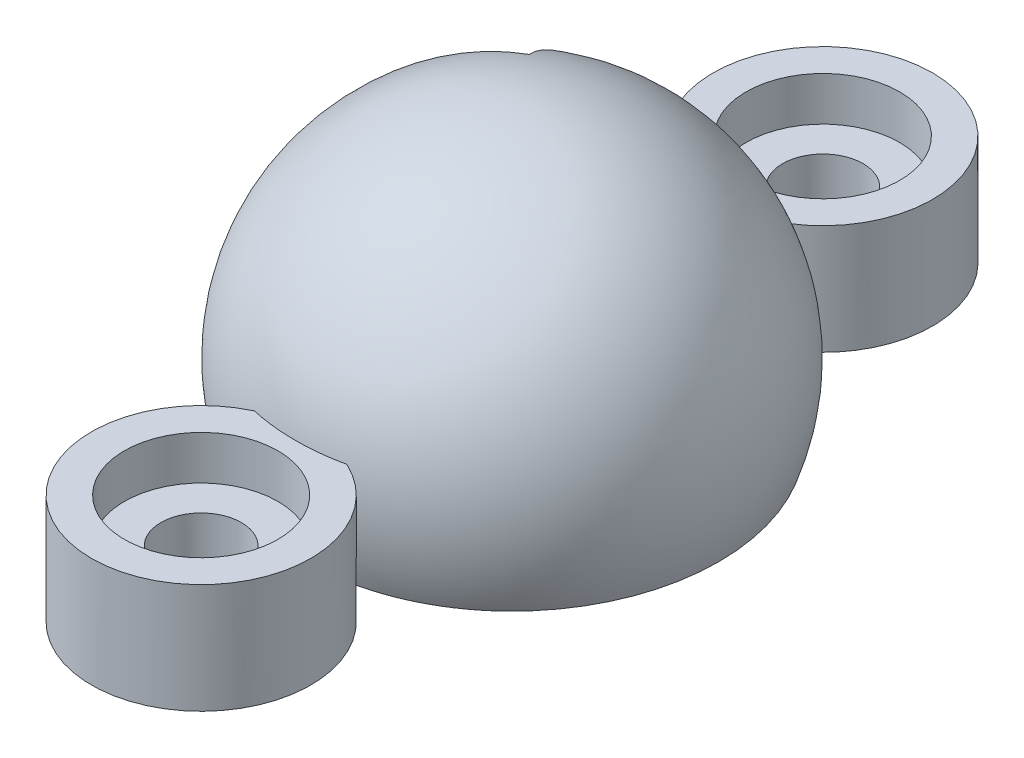
from build123d import *

# Parameters (mm, degrees)
RETAINER_FEATURE_2_PROFILE_W = 14
RETAINER_FEATURE_2_PROFILE_H = 5
RETAINER_FEATURE_2_DEPTH     = 14
RETAINER_FEATURE_3_PROFILE_R = 3
RETAINER_FEATURE_3_DEPTH     = 3
RETAINER_FEATURE_4_PROFILE_R = 3
RETAINER_FEATURE_4_DEPTH     = 3
RETAINER_FEATURE_6_PROFILE_R = 1.1
RETAINER_FEATURE_6_DEPTH     = 4.25
RETAINER_FEATURE_7_PROFILE_R = 2.1
RETAINER_FEATURE_7_DEPTH     = 1.45
RETAINER_FEATURE_8_PROFILE_R = 1.1
RETAINER_FEATURE_8_DEPTH     = 4.25
RETAINER_FEATURE_9_PROFILE_R = 2.1
RETAINER_FEATURE_9_DEPTH     = 1.45
RETAINER_FEATURE_12_DEPTH    = 10


with BuildPart() as part:
    # Retainer Feature 1 profile → Retainer Feature 1 (revolve)
    with BuildSketch(Plane(origin=(0, -73, 0), x_dir=(-1, 0, 0), z_dir=(0, -1, 0))):
        with BuildLine():
            Line((26.291651246, -6), (26.291651246, 6))
            ThreePointArc((26.291651246, 6), (20.291651246, 0), (26.291651246, -6))
        make_face()
    revolve(axis=Axis((-26.291651246, -73, -10), (0, 0, 1)))

    # Retainer Feature 2 profile → Retainer Feature 2 (cut)
    with BuildSketch(Plane.XY.offset(-7)):
        with Locations((-26.291651246, -68.5)):
            Rectangle(RETAINER_FEATURE_2_PROFILE_W, RETAINER_FEATURE_2_PROFILE_H)
    extrude(amount=RETAINER_FEATURE_2_DEPTH, mode=Mode.SUBTRACT)

    # Retainer Feature 3 profile → Retainer Feature 3 (add)
    with BuildSketch(Plane(origin=(0, -71, 0), x_dir=(-1, 0, 0), z_dir=(0, -1, 0))):
        with Locations((26.291651246, 8.5)):
            Circle(RETAINER_FEATURE_3_PROFILE_R)
    extrude(amount=RETAINER_FEATURE_3_DEPTH)

    # Retainer Feature 4 profile → Retainer Feature 4 (add)
    with BuildSketch(Plane(origin=(0, -71, 0), x_dir=(-1, 0, 0), z_dir=(0, -1, 0))):
        with Locations((26.291651246, -8.5)):
            Circle(RETAINER_FEATURE_4_PROFILE_R)
    extrude(amount=RETAINER_FEATURE_4_DEPTH)

    # Retainer Feature 5 profile → Retainer Feature 5 (revolve, cut)
    with BuildSketch(Plane(origin=(0, -73, 0), x_dir=(-1, 0, 0), z_dir=(0, -1, 0))):
        with BuildLine():
            Line((26.291651246, -3.15), (26.291651246, 3.15))
            ThreePointArc((26.291651246, 3.15), (23.141651246, 0), (26.291651246, -3.15))
        make_face()
    revolve(axis=Axis((-26.291651246, -73, -10), (0, 0, 1)), mode=Mode.SUBTRACT)

    # Retainer Feature 6 profile → Retainer Feature 6 (cut)
    with BuildSketch(Plane(origin=(0, -70, 0), x_dir=(-1, 0, 0), z_dir=(0, -1, 0))):
        with Locations(Location((26.291651246, 8.5, 0), (0, 0, 270))):
            Circle(RETAINER_FEATURE_6_PROFILE_R)
    extrude(amount=RETAINER_FEATURE_6_DEPTH, mode=Mode.SUBTRACT)

    # Retainer Feature 7 profile → Retainer Feature 7 (cut)
    with BuildSketch(Plane(origin=(0, -72.8, 0), x_dir=(-1, 0, 0), z_dir=(0, -1, 0))):
        with Locations(Location((26.291651246, 8.5, 0), (0, 0, 90))):
            Circle(RETAINER_FEATURE_7_PROFILE_R)
    extrude(amount=RETAINER_FEATURE_7_DEPTH, mode=Mode.SUBTRACT)

    # Retainer Feature 8 profile → Retainer Feature 8 (cut)
    with BuildSketch(Plane(origin=(0, -70, 0), x_dir=(-1, 0, 0), z_dir=(0, -1, 0))):
        with Locations(Location((26.291651246, -8.5, 0), (0, 0, 270))):
            Circle(RETAINER_FEATURE_8_PROFILE_R)
    extrude(amount=RETAINER_FEATURE_8_DEPTH, mode=Mode.SUBTRACT)

    # Retainer Feature 9 profile → Retainer Feature 9 (cut)
    with BuildSketch(Plane(origin=(0, -72.8, 0), x_dir=(-1, 0, 0), z_dir=(0, -1, 0))):
        with Locations(Location((26.291651246, -8.5, 0), (0, 0, 90))):
            Circle(RETAINER_FEATURE_9_PROFILE_R)
    extrude(amount=RETAINER_FEATURE_9_DEPTH, mode=Mode.SUBTRACT)

    # Middle Right Fixed Compression Ball Reta → Retainer Feature 12 (cut)
    with BuildSketch(Plane(origin=(-46.801806266, -32.220261504, -18.815460044), x_dir=(-0.25892602820646665, -0.17825517869277457, 0.9493062747008634), z_dir=(-0.7819246728070284, -0.5383086561091627, -0.3143526631246647))):
        Polygon((20.297287002, -41.528985171), (16.35135873, -46.567799523), (19.343154751, -48.910694434), (23.289083023, -43.871880083), align=None)
    extrude(amount=RETAINER_FEATURE_12_DEPTH, mode=Mode.SUBTRACT)


with BuildPart() as body_2:
    # Mirror1: mirrored copy
    add(part.part.mirror(Plane(origin=(0, 0, 0), x_dir=(0, 0, 1), z_dir=(0, -1, 0))))


solid = body_2.part
